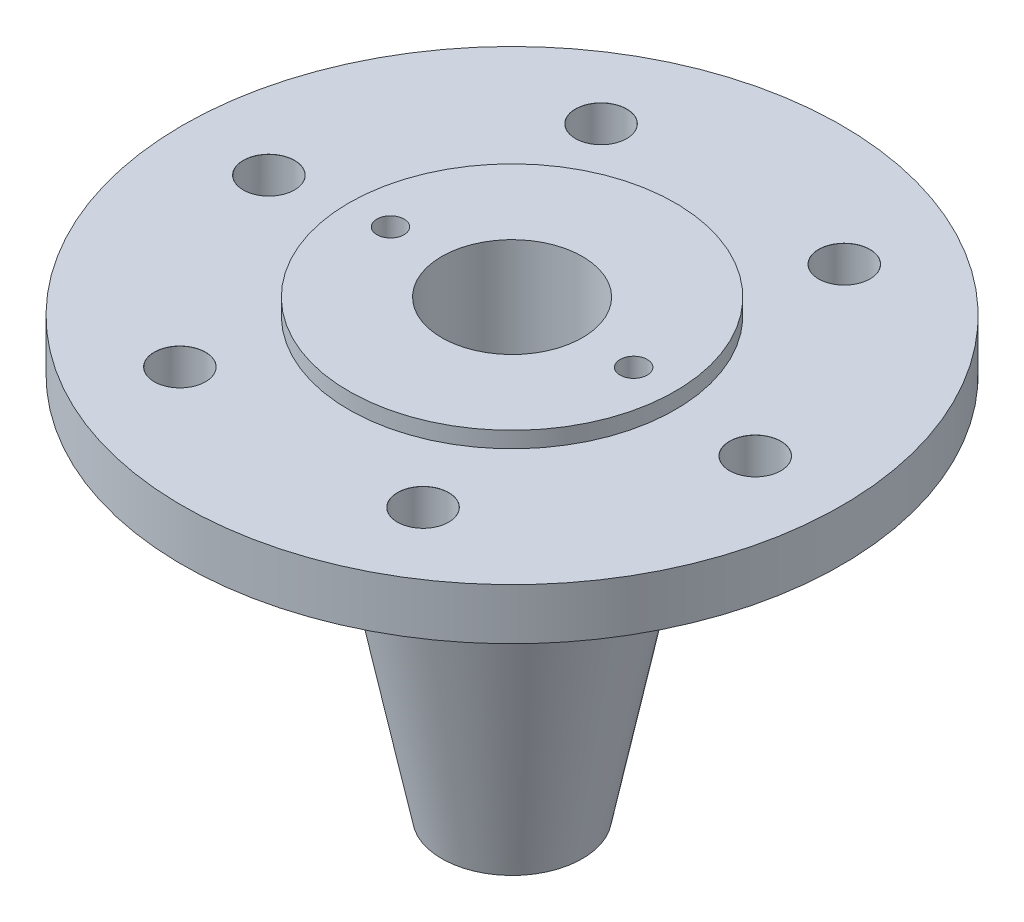
from build123d import *

# Parameters (mm, degrees)
FILLET1_R                            = 5
F_16_0_16_DIAMETER_HOLE1_D           = 16
F_16_0_16_DIAMETER_HOLE1_CSINK_D     = 16.05
F_16_0_16_DIAMETER_HOLE1_CSINK_ANGLE = 90
CIRPATTERN1_COUNT                    = 6
M10X1_5_TAPPED_HOLE1_D               = 8.5
M10X1_5_TAPPED_HOLE1_DEPTH           = 18
M10X1_5_TAPPED_HOLE1_TIP             = 2.553657631


with BuildPart() as part:
    # Sketch1 → Revolve1 (revolve)
    with BuildSketch(Plane.XY, mode=Mode.PRIVATE) as revolve1_sk:
        Polygon((0, 0), (51, 0), (51, -5), (103, -5), (103, -21), (54, -21), (54, -31), (44, -31), (22, -141), (0, -141), align=None)
    revolve(revolve1_sk.sketch.rotate(Axis((0, 0, 0), (0, -1, 0)), 180), axis=Axis((0, 0, 0), (0, -1, 0)))

    # Sketch2 → Cut-Revolve1 (revolve, cut)
    with BuildSketch(Plane.XY):
        Polygon((-11.75, -141), (-11.75, -103), (-16, -100.240017729), (-16, -86.247037966), (-11, -83), (-11, -51.143483525), (-22, -44), (-22, 0), (0, 0), (0, -141), align=None)
    revolve(axis=Axis((0, 0, 0), (0, -1, 0)), mode=Mode.SUBTRACT)

    # Fillet1
    fillet1_edges = [part.edges().sort_by_distance(p)[0] for p in [
        (44, -31, 0),
    ]]
    fillet(fillet1_edges, radius=FILLET1_R)

    # Ø16.0 (16) Diameter Hole1 (through all)
    with Locations(Plane(origin=(0, -5, 0), x_dir=(1, 0, 0), z_dir=(0, 1, 0))):
        with Locations((-76, 0)):
            f_16_0_16_diameter_hole1 = CounterSinkHole(F_16_0_16_DIAMETER_HOLE1_D / 2, F_16_0_16_DIAMETER_HOLE1_CSINK_D / 2, counter_sink_angle=F_16_0_16_DIAMETER_HOLE1_CSINK_ANGLE)

    # CirPattern1: Ø16.0 (16) Diameter Hole1 ×6 about axis
    cirpattern1_axis = Axis((0, 0, 0), (0, 1, 0))
    for i in range(1, CIRPATTERN1_COUNT):
        add(f_16_0_16_diameter_hole1.rotate(cirpattern1_axis, i * 360 / CIRPATTERN1_COUNT), mode=Mode.SUBTRACT)

    # M10x1.5 Tapped Hole1
    with Locations(Plane(origin=(0, 0, 0), x_dir=(1, 0, 0), z_dir=(0, 1, 0))):
        with Locations((38, 0), (-38, 0)):
            Hole(M10X1_5_TAPPED_HOLE1_D / 2, depth=M10X1_5_TAPPED_HOLE1_DEPTH)
            with Locations((0, 0, -(M10X1_5_TAPPED_HOLE1_DEPTH + M10X1_5_TAPPED_HOLE1_TIP / 2))):  # 118° drill point
                Cone(0, M10X1_5_TAPPED_HOLE1_D / 2, M10X1_5_TAPPED_HOLE1_TIP, mode=Mode.SUBTRACT)


solid = part.part
